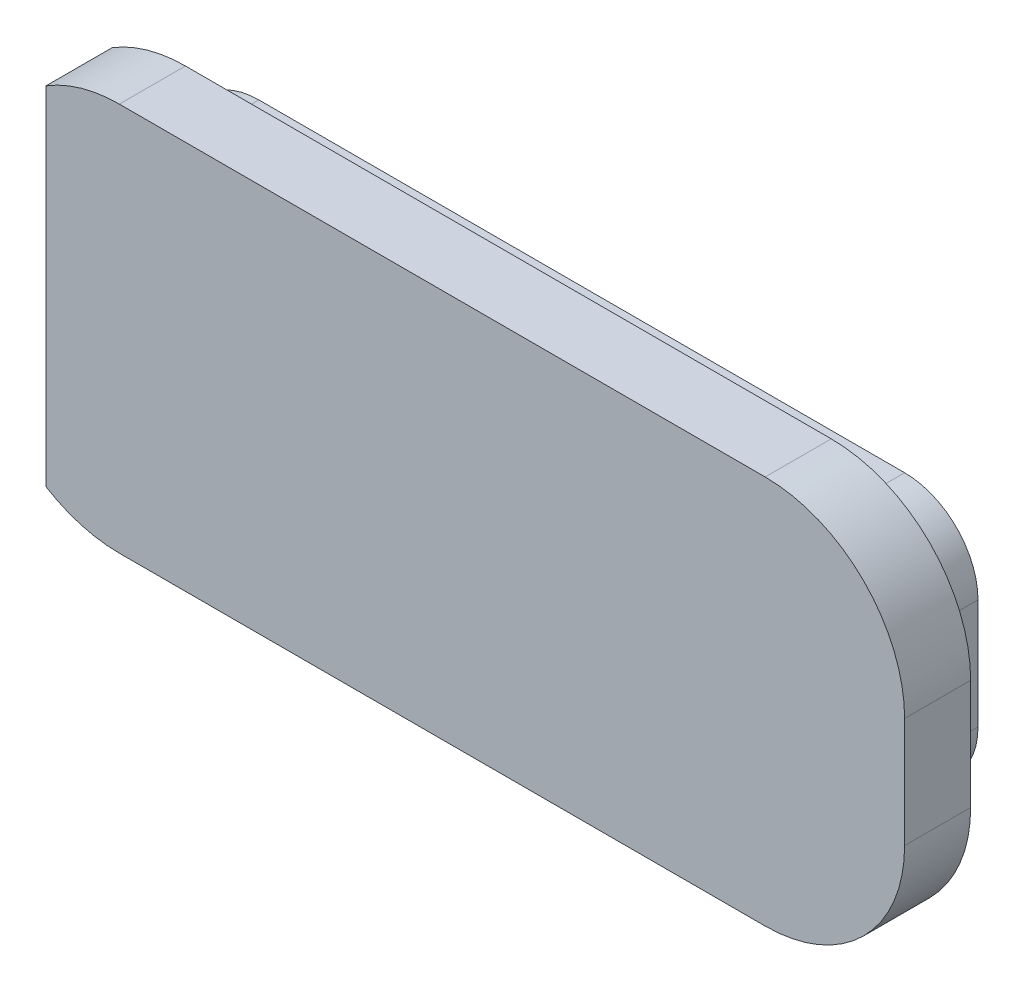
from build123d import *

# Parameters (mm, degrees)
LOCATING_TONGUE_DEPTH = 1
COVER_FLANGE_DEPTH    = 0.9


with BuildPart() as part:
    # Locating_tongue_profile → Locating_tongue (new body)
    with BuildSketch(Plane.XY):
        with BuildLine():
            Line((1, 0), (9.8, 0))
            ThreePointArc((9.8, 0), (10.507106781, 0.292893219), (10.8, 1))
            Line((10.8, 1), (10.8, 2.5))
            ThreePointArc((10.8, 2.5), (10.507106781, 3.207106781), (9.8, 3.5))
            Line((9.8, 3.5), (1, 3.5))
            ThreePointArc((1, 3.5), (0.292893219, 3.207106781), (0, 2.5))
            Line((0, 2.5), (0, 1))
            ThreePointArc((0, 1), (0.292893219, 0.292893219), (1, 0))
        make_face()
    extrude(amount=-LOCATING_TONGUE_DEPTH)

    # Cover_flange_profile → Cover_flange (add)
    with BuildSketch(Plane.XY):
        with BuildLine():
            Line((0, -0.615549442), (0, 4.115549442))
            ThreePointArc((0, 4.115549442), (0.480165382, 4.327504301), (1, 4.4))
            Line((1, 4.4), (9.8, 4.4))
            ThreePointArc((9.8, 4.4), (11.143502884, 3.843502884), (11.7, 2.5))
            Line((11.7, 2.5), (11.7, 1))
            ThreePointArc((11.7, 1), (11.143502884, -0.343502884), (9.8, -0.9))
            Line((9.8, -0.9), (1, -0.9))
            ThreePointArc((1, -0.9), (0.480165382, -0.827504301), (0, -0.615549442))
        make_face()
    extrude(amount=COVER_FLANGE_DEPTH)


solid = part.part
